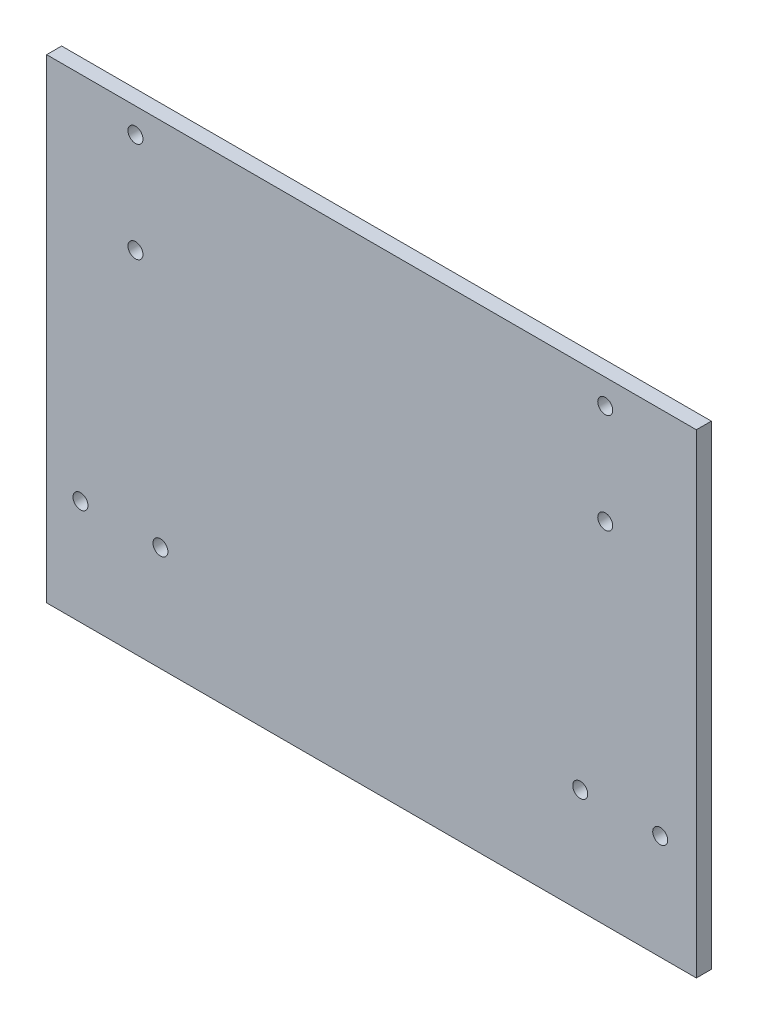
from build123d import *

# Parameters (mm, degrees)
SKETCH_1_W          = 130
SKETCH_1_H          = 95
EXTRUDE_1_DEPTH     = 3
SKETCH_3_R          = 1.5
CUT_EXTRUDE_2_DEPTH = 10
SKETCH_4_R          = 1.5
CUT_EXTRUDE_3_DEPTH = 10


with BuildPart() as part:
    # 草图1 → 凸台-拉伸1 (new body)
    with BuildSketch(Plane.XY):
        Rectangle(SKETCH_1_W, SKETCH_1_H)
    extrude(amount=EXTRUDE_1_DEPTH)

    # 草图3 → 切除-拉伸2 (cut)
    with BuildSketch(Plane(origin=(0, 0, 0), x_dir=(-1, 0, 0), z_dir=(0, 0, -1))):
        with Locations((-57.767112616, -26.5)):
            Circle(SKETCH_3_R)
        with Locations((-41.767112616, -26.5)):
            Circle(SKETCH_3_R)
        with Locations((42.232887384, -26.5)):
            Circle(SKETCH_3_R)
        with Locations((58.232887384, -26.5)):
            Circle(SKETCH_3_R)
    extrude(amount=-CUT_EXTRUDE_2_DEPTH, mode=Mode.SUBTRACT)

    # 草图4 → 切除-拉伸3 (cut)
    with BuildSketch(Plane(origin=(0, 0, 0), x_dir=(-1, 0, 0), z_dir=(0, 0, -1))):
        with Locations((-46.767112616, 42.5)):
            Circle(SKETCH_4_R)
        with Locations((-46.767112616, 22.5)):
            Circle(SKETCH_4_R)
        with Locations((47.232887384, 42.5)):
            Circle(SKETCH_4_R)
        with Locations((47.232887384, 22.5)):
            Circle(SKETCH_4_R)
    extrude(amount=-CUT_EXTRUDE_3_DEPTH, mode=Mode.SUBTRACT)


solid = part.part
